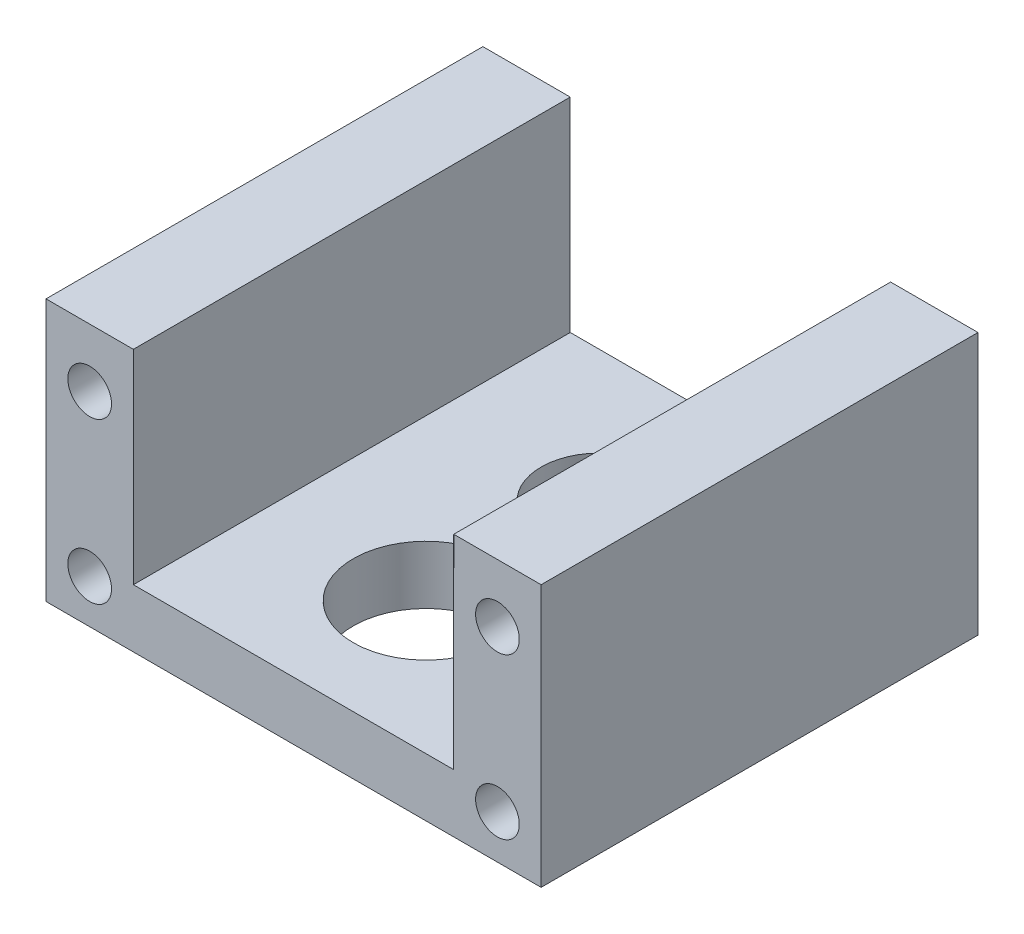
from build123d import *

# Parameters (mm, degrees)
SKETCH_1_W          = 34
SKETCH_1_H          = 30
SKETCH_1_R          = 4
SKETCH_1_R_2        = 5
EXTRUDE_1_DEPTH     = 4
SKETCH_3_W          = 6
SKETCH_3_H          = 30
EXTRUDE_2_DEPTH     = 15
SKETCH_4_R          = 1.5
CUT_EXTRUDE_1_DEPTH = 40.37003937
SKETCH_5_W          = 34
SKETCH_5_H          = 1
CUT_EXTRUDE_2_DEPTH = 40.37003937
CHAMFER_1_SIZE      = 1


with BuildPart() as part:
    # 草图1 → 凸台-拉伸1 (new body)
    with BuildSketch(Plane(origin=(0, 0, 0), x_dir=(1, 0, 0), z_dir=(0, 1, 0))):
        Rectangle(SKETCH_1_W, SKETCH_1_H)
        with Locations(Location((0, 6, 0), (0, 0, 270))):
            Circle(SKETCH_1_R, mode=Mode.SUBTRACT)
        with Locations(Location((0, -5.9, 0), (0, 0, 270))):
            Circle(SKETCH_1_R_2, mode=Mode.SUBTRACT)
    extrude(amount=EXTRUDE_1_DEPTH)

    # 草图3 → 凸台-拉伸2 (add)
    with BuildSketch(Plane(origin=(0, 4, 0), x_dir=(1, 0, 0), z_dir=(0, 1, 0))):
        with Locations((-14, 0)):
            Rectangle(SKETCH_3_W, SKETCH_3_H)
        with Locations((14, 0)):
            Rectangle(SKETCH_3_W, SKETCH_3_H)
    extrude(amount=EXTRUDE_2_DEPTH)

    # 草图4 → 切除-拉伸1 (cut, through all)
    with BuildSketch(Plane(origin=(0, 0, -15), x_dir=(-1, 0, 0), z_dir=(0, 0, -1))):
        with Locations((-14, 3)):
            Circle(SKETCH_4_R)
        with Locations((-14, 14)):
            Circle(SKETCH_4_R)
        with Locations(Location((14, 3, 0), (0, 0, 180))):
            Circle(SKETCH_4_R)
        with Locations(Location((14, 14, 0), (0, 0, 180))):
            Circle(SKETCH_4_R)
    extrude(amount=-CUT_EXTRUDE_1_DEPTH, mode=Mode.SUBTRACT)

    # 草图5 → 切除-拉伸2 (cut, through all)
    with BuildSketch(Plane(origin=(0, 0, -15), x_dir=(-1, 0, 0), z_dir=(0, 0, -1))):
        with Locations((0, 18.5)):
            Rectangle(SKETCH_5_W, SKETCH_5_H)
    extrude(amount=-CUT_EXTRUDE_2_DEPTH, mode=Mode.SUBTRACT)

    # 倒角1
    chamfer_1_edges = [part.edges().sort_by_distance(p)[0] for p in [
        (0, 0, -10),
    ]]
    chamfer(chamfer_1_edges, length=CHAMFER_1_SIZE)


solid = part.part
